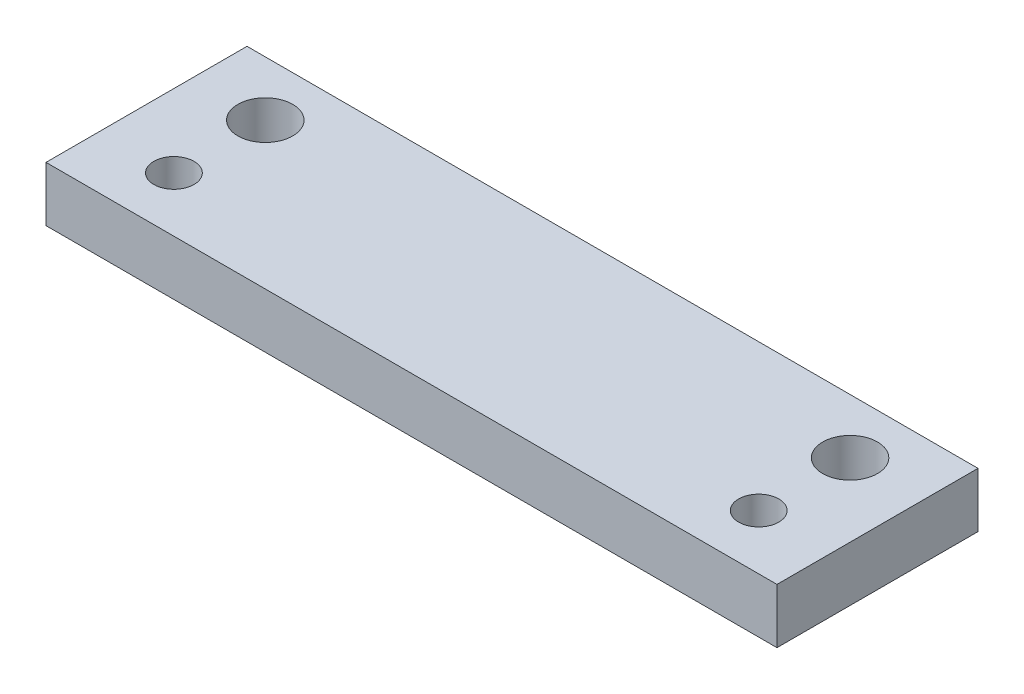
from build123d import *

# Parameters (mm, degrees)
SKETCH1_W           = 40
SKETCH1_H           = 11
SKETCH1_R           = 1.1
SKETCH1_R_2         = 1.5
BOSS_EXTRUDE1_DEPTH = 3


with BuildPart() as part:
    # Sketch1 → Boss-Extrude1 (new body)
    with BuildSketch(Plane(origin=(0, 0, 0), x_dir=(1, 0, 0), z_dir=(0, 1, 0))):
        with Locations((20, 5.5)):
            Rectangle(SKETCH1_W, SKETCH1_H)
        with Locations((4, 3)):
            Circle(SKETCH1_R, mode=Mode.SUBTRACT)
        with Locations((36, 3)):
            Circle(SKETCH1_R, mode=Mode.SUBTRACT)
        with Locations((4, 8)):
            Circle(SKETCH1_R_2, mode=Mode.SUBTRACT)
        with Locations((36, 8)):
            Circle(SKETCH1_R_2, mode=Mode.SUBTRACT)
    extrude(amount=BOSS_EXTRUDE1_DEPTH)


solid = part.part
